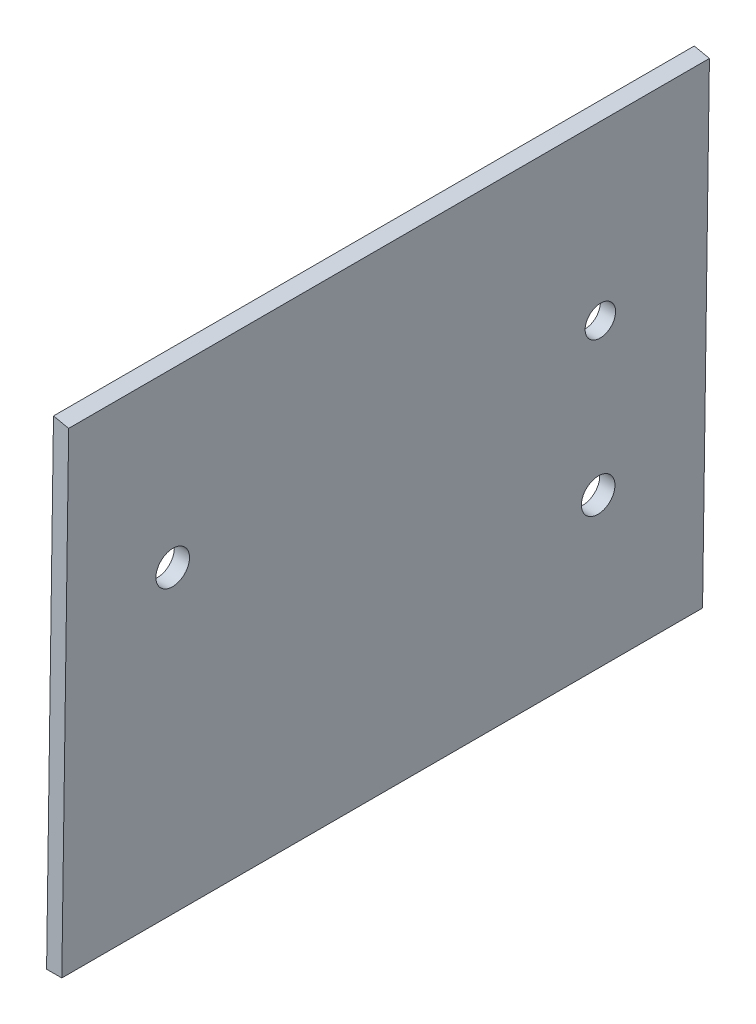
from build123d import *

# Parameters (mm, degrees)
BOSS_EXTRUDE1_DEPTH = 534.6
SKETCH2_R           = 12.7
CUT_EXTRUDE1_DEPTH  = 18.288
SKETCH3_R           = 14
CUT_EXTRUDE2_DEPTH  = 18.288
SKETCH4_R           = 14
CUT_EXTRUDE3_DEPTH  = 18.288


with BuildPart() as part:
    # Sketch1 → Boss-Extrude1 (new body)
    with BuildSketch(Plane.XY):
        Polygon((0, 0), (5.762672042, 402.6498479), (18.424747765, 400), (12.7, 0), align=None)
    extrude(amount=BOSS_EXTRUDE1_DEPTH)

    # Sketch2 → Cut-Extrude1 (cut)
    with BuildSketch(Plane(origin=(12.697399197, -0.181723519, 0), x_dir=(0, 0, -1), z_dir=(0.9998976009274501, -0.014310403891230014, 0))):
        with Locations(Location((-88.9, 254.181742129, 0), (0, 0, 90))):
            Circle(SKETCH2_R)
    extrude(amount=-CUT_EXTRUDE1_DEPTH, mode=Mode.SUBTRACT)

    # Sketch3 → Cut-Extrude2 (cut)
    with BuildSketch(Plane(origin=(12.697399197, -0.181723519, 0), x_dir=(0, 0, -1), z_dir=(0.9998976009274501, -0.014310403891230014, 0))):
        with Locations(Location((-88.9, 127.181742129, 0), (0, 0, 90))):
            Circle(SKETCH3_R)
    extrude(amount=-CUT_EXTRUDE2_DEPTH, mode=Mode.SUBTRACT)

    # Sketch4 → Cut-Extrude3 (cut)
    with BuildSketch(Plane(origin=(12.697399197, -0.181723519, 0), x_dir=(0, 0, -1), z_dir=(0.9998976009274501, -0.014310403891230014, 0))):
        with Locations(Location((-445.7, 254.181742129, 0), (0, 0, 90))):
            Circle(SKETCH4_R)
    extrude(amount=-CUT_EXTRUDE3_DEPTH, mode=Mode.SUBTRACT)


solid = part.part
